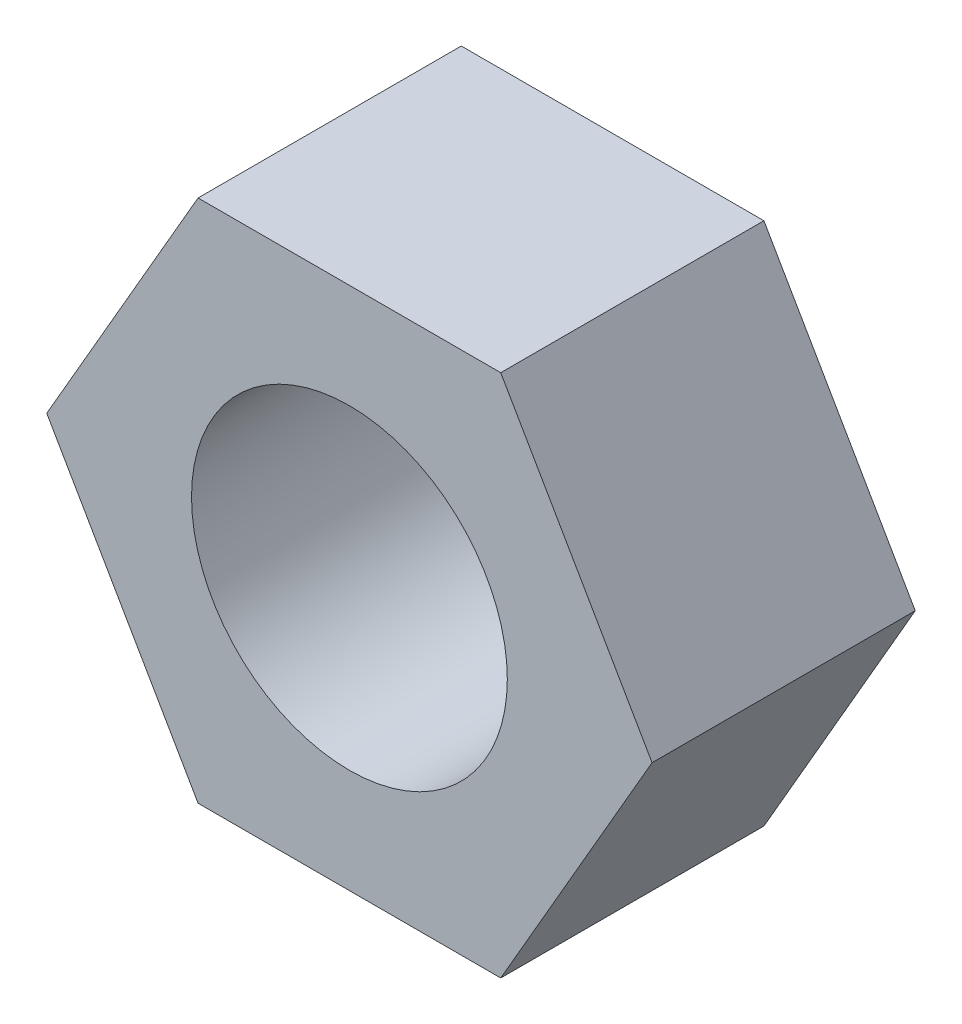
from build123d import *

# Parameters (mm, degrees)
SKETCH1_R           = 3
BOSS_EXTRUDE1_DEPTH = 5


with BuildPart() as part:
    # Sketch1 → Boss-Extrude1 (new body)
    with BuildSketch(Plane.XY):
        Polygon((-2.875, 4.979646072), (-5.75, 0), (-2.875, -4.979646072), (2.875, -4.979646072), (5.75, 0), (2.875, 4.979646072), align=None)
        Circle(SKETCH1_R, mode=Mode.SUBTRACT)
    extrude(amount=BOSS_EXTRUDE1_DEPTH)


solid = part.part
